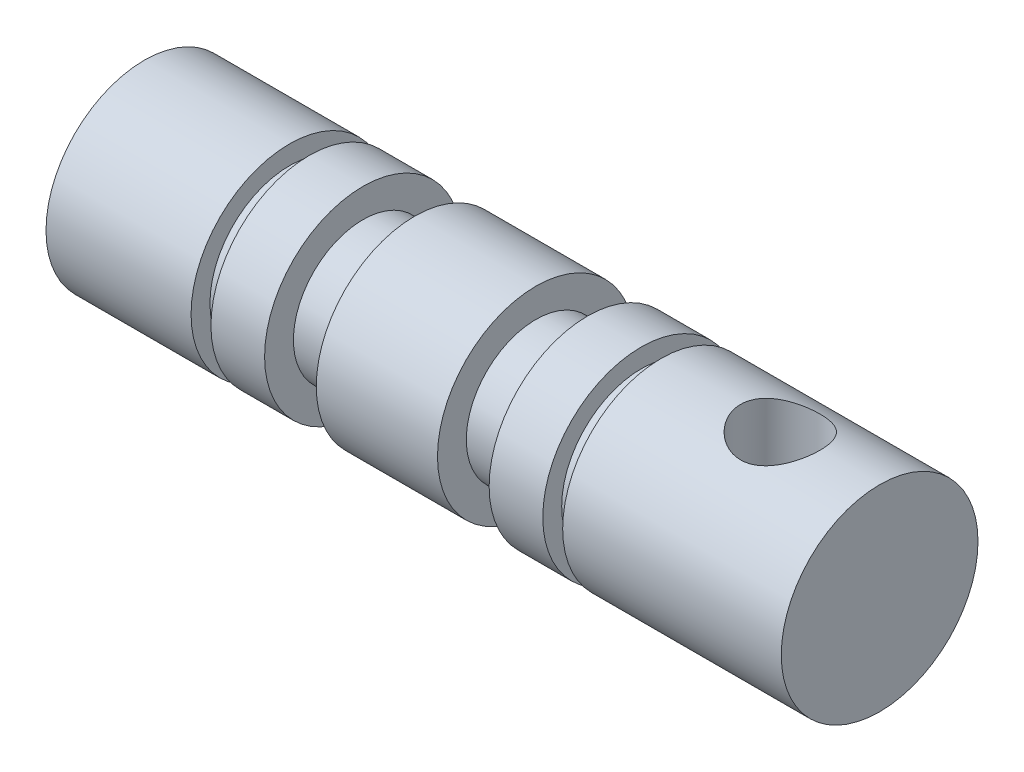
from build123d import *

# Parameters (mm, degrees)
SKETCH_1_R               = 4.95
EXTRUDE_1_DEPTH          = 37
CUT_EXTRUDE_START        = 11
SKETCH_1_3_R             = 4.95
SKETCH_1_3_R_2           = 3.5
CUT_EXTRUDE_1_DEPTH      = 2.6
CUT_EXTRUDE_START_2      = 19.7
SKETCH_1_4_R             = 4.95
SKETCH_1_4_R_2           = 3.5
CUT_EXTRUDE_2_DEPTH      = 2.6
SKETCH_2_R               = 1.5
CUT_EXTRUDE_3_DEPTH      = 10
SKETCH_3_R               = 1.6
CUT_EXTRUDE_4_DEPTH      = 38.656407157
CUT_EXTRUDE_START_3      = -7.3
SKETCH_4_R               = 4.95
SKETCH_4_R_2             = 4
CUT_EXTRUDE_5_DEPTH      = 1
CUT_EXTRUDE_START_4      = -25
SKETCH_4_2_R             = 4.95
SKETCH_4_2_R_2           = 4
CUT_EXTRUDE_6_DEPTH      = 1
CUT_EXTRUDE_7_DEPTH      = 38.656407184
CUT_EXTRUDE_7_DEPTH_BACK = 38.656407184
SKETCH_5_R               = 2


with BuildPart() as part:
    # Эскиз1 → Бобышка-Вытянуть1 (new body)
    with BuildSketch(Plane(origin=(0, 0, 0), x_dir=(0, 0, -1), z_dir=(1, 0, 0))):
        Circle(SKETCH_1_R)
    extrude(amount=EXTRUDE_1_DEPTH)

    # Эскиз1<3> → Вырез-Вытянуть1 (cut)
    with BuildSketch(Plane(origin=(0, 0, 0), x_dir=(0, 0, -1), z_dir=(1, 0, 0)).offset(CUT_EXTRUDE_START)):
        Circle(SKETCH_1_3_R)
        Circle(SKETCH_1_3_R_2, mode=Mode.SUBTRACT)
    extrude(amount=CUT_EXTRUDE_1_DEPTH, mode=Mode.SUBTRACT)

    # Эскиз1<4> → Вырез-Вытянуть2 (cut)
    with BuildSketch(Plane(origin=(0, 0, 0), x_dir=(0, 0, -1), z_dir=(1, 0, 0)).offset(CUT_EXTRUDE_START_2)):
        Circle(SKETCH_1_4_R)
        Circle(SKETCH_1_4_R_2, mode=Mode.SUBTRACT)
    extrude(amount=CUT_EXTRUDE_2_DEPTH, mode=Mode.SUBTRACT)

    # Эскиз2 → Вырез-Вытянуть3 (cut)
    with BuildSketch(Plane.ZY):
        Circle(SKETCH_2_R)
    extrude(amount=-CUT_EXTRUDE_3_DEPTH, mode=Mode.SUBTRACT)

    # Эскиз3 → Вырез-Вытянуть4 (cut, through all)
    with BuildSketch(Plane(origin=(0, 0, 0), x_dir=(1, 0, 0), z_dir=(0, 1, 0))):
        with Locations((3.3, 0)):
            Circle(SKETCH_3_R)
    extrude(amount=-CUT_EXTRUDE_4_DEPTH, mode=Mode.SUBTRACT)

    # Эскиз4 → Вырез-Вытянуть5 (cut)
    with BuildSketch(Plane.ZY.offset(CUT_EXTRUDE_START_3)):
        Circle(SKETCH_4_R)
        Circle(SKETCH_4_R_2, mode=Mode.SUBTRACT)
    extrude(amount=-CUT_EXTRUDE_5_DEPTH, mode=Mode.SUBTRACT)

    # Эскиз4<2> → Вырез-Вытянуть6 (cut)
    with BuildSketch(Plane.ZY.offset(CUT_EXTRUDE_START_4)):
        Circle(SKETCH_4_2_R)
        Circle(SKETCH_4_2_R_2, mode=Mode.SUBTRACT)
    extrude(amount=-CUT_EXTRUDE_6_DEPTH, mode=Mode.SUBTRACT)

    # Эскиз5 → Вырез-Вытянуть7 (cut, two sides: drawn at the far end of the back side and taken through both)
    with BuildSketch(Plane(origin=(0, 0, 0), x_dir=(1, 0, 0), z_dir=(0, 1, 0)).offset(-CUT_EXTRUDE_7_DEPTH_BACK)):
        with Locations((32, 0)):
            Circle(SKETCH_5_R)
    extrude(amount=CUT_EXTRUDE_7_DEPTH + CUT_EXTRUDE_7_DEPTH_BACK, mode=Mode.SUBTRACT)


solid = part.part
